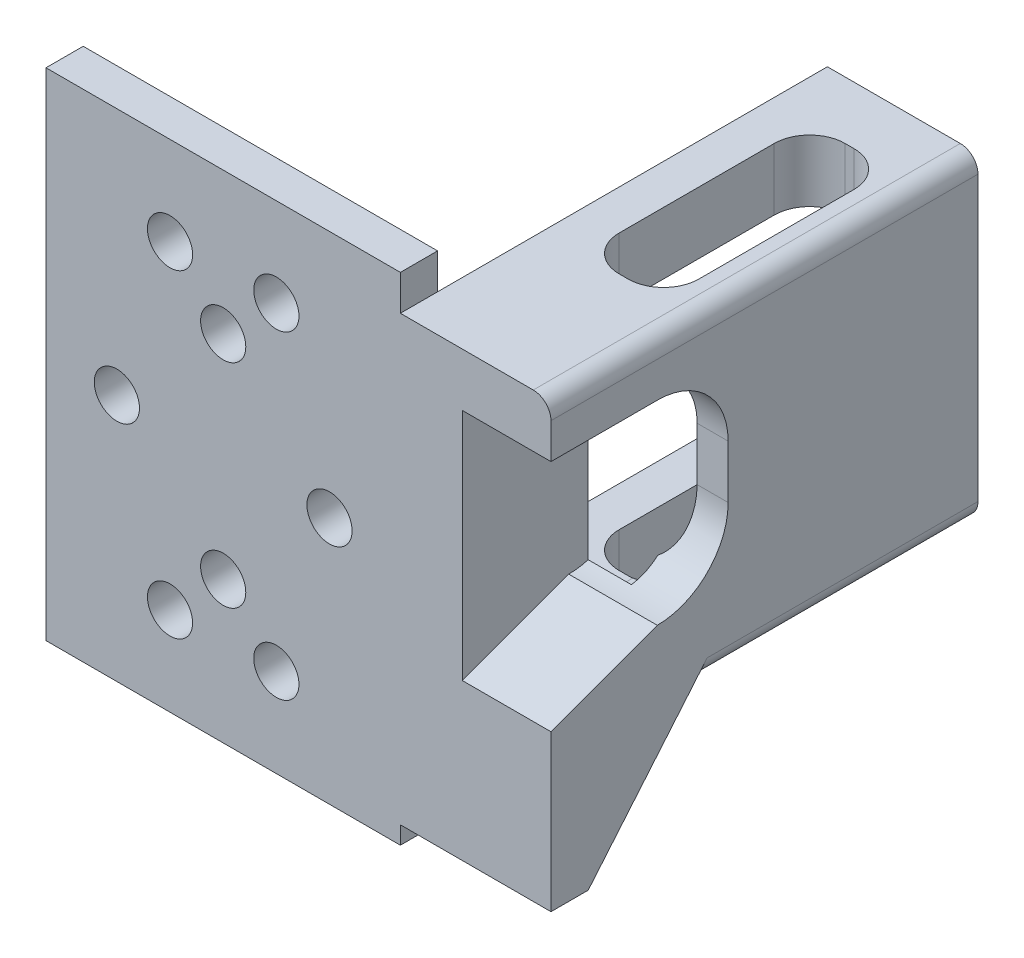
from build123d import *

# Parameters (mm, degrees)
SKETCH1_R               = 1.275
BOSS_EXTRUDE1_DEPTH     = 2.1
SKETCH1_3_W             = 8.5
SKETCH1_3_H             = 25
BOSS_EXTRUDE2_DEPTH     = 24.1
CUT_EXTRUDE1_DEPTH      = 5
CUT_EXTRUDE2_DEPTH      = 46.486921197
CUT_EXTRUDE2_DEPTH_BACK = 46.486921197
CUT_EXTRUDE3_DEPTH      = 17
CUT_EXTRUDE4_REACH      = 48.659
FILLET1_R               = 1


with BuildPart() as part:
    # Sketch1 → Boss-Extrude1 (new body)
    with BuildSketch(Plane.XY):
        Polygon((0, 28), (0, 0), (20, 0), (20, 1), (20, 26), (20, 28), align=None)
        with Locations((7, 5)):
            Circle(SKETCH1_R, mode=Mode.SUBTRACT)
        with Locations((13, 5)):
            Circle(SKETCH1_R, mode=Mode.SUBTRACT)
        with Locations((10, 8)):
            Circle(SKETCH1_R, mode=Mode.SUBTRACT)
        with Locations((4, 14)):
            Circle(SKETCH1_R, mode=Mode.SUBTRACT)
        with Locations((10, 20)):
            Circle(SKETCH1_R, mode=Mode.SUBTRACT)
        with Locations((7, 23)):
            Circle(SKETCH1_R, mode=Mode.SUBTRACT)
        with Locations((13, 23)):
            Circle(SKETCH1_R, mode=Mode.SUBTRACT)
        with Locations((16, 14)):
            Circle(SKETCH1_R, mode=Mode.SUBTRACT)
    extrude(amount=-BOSS_EXTRUDE1_DEPTH)

    # Sketch1<3> → Boss-Extrude2 (add)
    with BuildSketch(Plane.XY):
        with Locations((24.25, 13.5)):
            Rectangle(SKETCH1_3_W, SKETCH1_3_H)
    extrude(amount=-BOSS_EXTRUDE2_DEPTH)

    # Sketch2 → Cut-Extrude1 (cut)
    with BuildSketch(Plane(origin=(28.5, 0, 0), x_dir=(0, 0, -1), z_dir=(1, 0, 0))):
        with BuildLine():
            Line((0, 23), (6, 23))
            ThreePointArc((6, 23), (8.828427125, 21.828427125), (10, 19))
            Line((10, 19), (10, 16))
            ThreePointArc((10, 16), (8.828427125, 13.171572875), (6, 12))
            Line((6, 12), (0, 9.797))
            Line((0, 9.797), (0, 23))
        make_face()
    extrude(amount=-CUT_EXTRUDE1_DEPTH, mode=Mode.SUBTRACT)

    # Sketch3 → Cut-Extrude2 (cut, two sides: drawn at the far end of the back side and taken through both)
    with BuildSketch(Plane(origin=(0, 26, 0), x_dir=(1, 0, 0), z_dir=(0, 1, 0)).offset(-CUT_EXTRUDE2_DEPTH_BACK)):
        with BuildLine():
            Line((24.75, 20.85), (24.25, 20.85))
            ThreePointArc((24.25, 20.85), (22.835786438, 20.264213562), (22.25, 18.85))
            Line((22.25, 18.85), (22.25, 10.1))
            ThreePointArc((22.25, 10.1), (22.835786438, 8.685786438), (24.25, 8.1))
            Line((24.25, 8.1), (24.75, 8.1))
            ThreePointArc((24.75, 8.1), (26.164213562, 8.685786438), (26.75, 10.1))
            Line((26.75, 10.1), (26.75, 18.85))
            ThreePointArc((26.75, 18.85), (26.164213562, 20.264213562), (24.75, 20.85))
        make_face()
    extrude(amount=CUT_EXTRUDE2_DEPTH + CUT_EXTRUDE2_DEPTH_BACK, mode=Mode.SUBTRACT)

    # Sketch4 → Cut-Extrude3 (cut)
    with BuildSketch(Plane(origin=(0, 0, -24.1), x_dir=(-1, 0, 0), z_dir=(0, 0, -1))):
        with BuildLine():
            Line((-20, 11.5), (-25, 11.5))
            ThreePointArc((-25, 11.5), (-25.707106781, 11.792893219), (-26, 12.5))
            Line((-26, 12.5), (-26, 21.5))
            ThreePointArc((-26, 21.5), (-25.707106781, 22.207106781), (-25, 22.5))
            Line((-25, 22.5), (-20, 22.5))
            Line((-20, 22.5), (-20, 11.5))
        make_face()
    extrude(amount=-CUT_EXTRUDE3_DEPTH, mode=Mode.SUBTRACT)

    # Sketch6 → Cut-Extrude4 (cut, up to next)
    with BuildSketch(Plane(origin=(28.5, 0, 0), x_dir=(0, 0, -1), z_dir=(1, 0, 0)), mode=Mode.PRIVATE) as cut_extrude4_sk1:
        Polygon((2.1, 1), (24.1, 1), (24.1, 8), (7.973697418, 8), align=None)
    cut_extrude4_tool1 = extrude(cut_extrude4_sk1.sketch, amount=-CUT_EXTRUDE4_REACH, mode=Mode.PRIVATE) & part.part
    add(cut_extrude4_tool1.solids().sort_by_distance((28.5, 4.320265, -14.493016))[0], mode=Mode.SUBTRACT)

    # Fillet1
    fillet1_edges = [part.edges().sort_by_distance(p)[0] for p in [
        (28.5, 8, -16.036848709),
        (28.5, 26, -12.05),
    ]]
    fillet(fillet1_edges, radius=FILLET1_R)


solid = part.part
